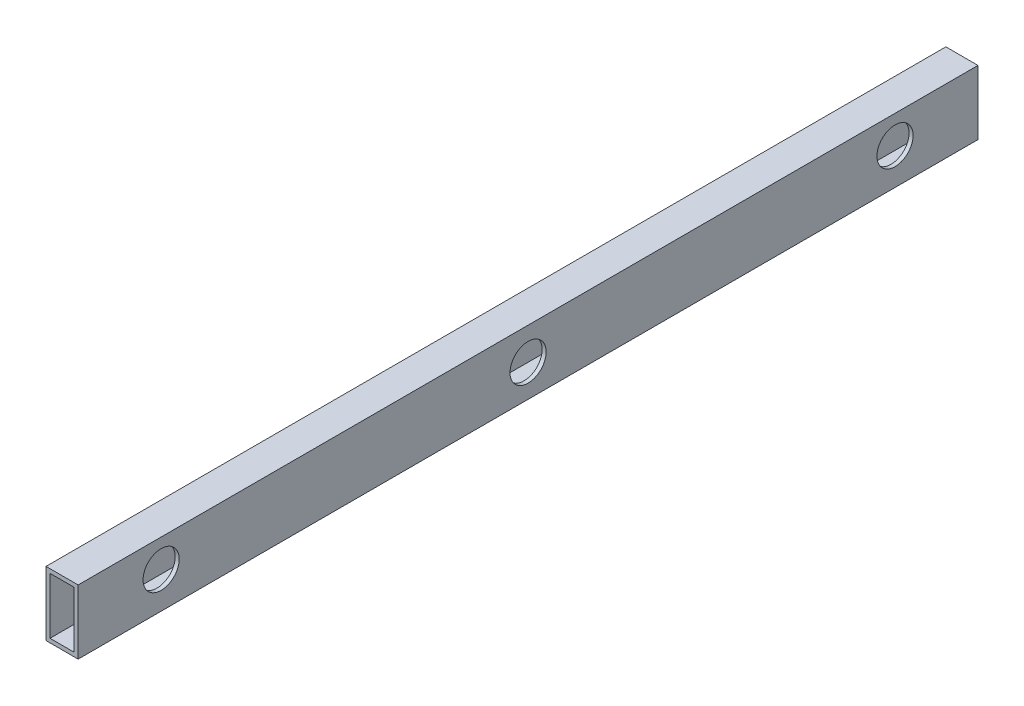
from build123d import *

# Parameters (mm, degrees)
SKETCH1_W           = 25.4
SKETCH1_H           = 50.8
SKETCH1_W_2         = 19.05
SKETCH1_H_2         = 44.45
BOSS_EXTRUDE1_DEPTH = 355.6
SKETCH2_R           = 14.2875
CUT_EXTRUDE1_DEPTH  = 446.225122831


with BuildPart() as part:
    # Sketch1 → Boss-Extrude1 (new body)
    with BuildSketch(Plane.XY):
        with Locations((254, 0)):
            Rectangle(SKETCH1_W, SKETCH1_H)
        with Locations((254, 0)):
            Rectangle(SKETCH1_W_2, SKETCH1_H_2, mode=Mode.SUBTRACT)
    boss_extrude1 = extrude(amount=BOSS_EXTRUDE1_DEPTH)

    # Mirror1: Boss-Extrude1 across plane
    add(boss_extrude1.mirror(Plane.XY))

    # Sketch2 → Cut-Extrude1 (cut, through all)
    with BuildSketch(Plane(origin=(0, 0, 0), x_dir=(0, 0, -1), z_dir=(1, 0, 0))):
        with Locations((290.007440579, 3.175)):
            Circle(SKETCH2_R)
        Circle(SKETCH2_R)
        with Locations((-290.007440579, 3.175)):
            Circle(SKETCH2_R)
    extrude(amount=CUT_EXTRUDE1_DEPTH, mode=Mode.SUBTRACT)


solid = part.part
